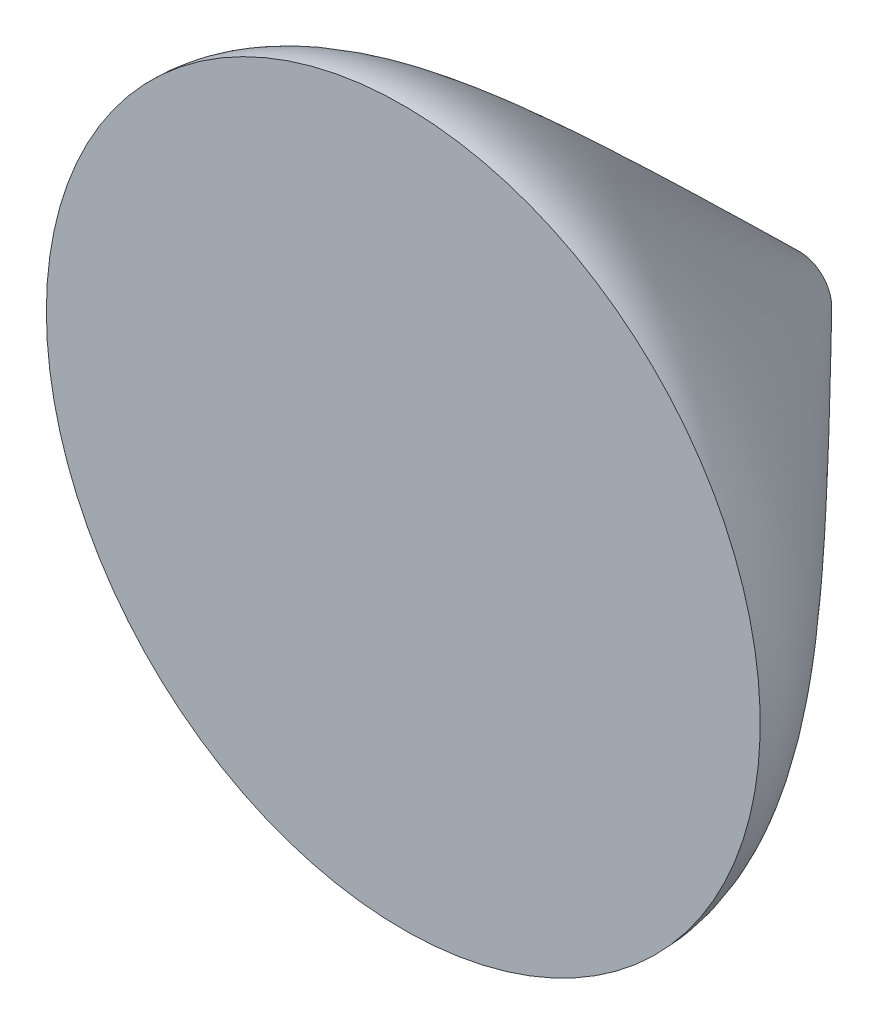
from build123d import *

# Parameters (mm, degrees)
SKETCH2_W = 4.5
SKETCH2_H = 5


with BuildPart() as part:
    # Sketch2 → Revolve1 (revolve)
    with BuildSketch(Plane(origin=(0, 0, 0), x_dir=(1, 0, 0), z_dir=(0, 1, 0))):
        with Locations((-2.25, 0)):
            Rectangle(SKETCH2_W, SKETCH2_H)
    revolve(axis=Axis((0, 0, -2.5), (0, 0, 1)))

    # Sketch3 → Cut-Revolve5 (revolve, cut)
    with BuildSketch(Plane(origin=(0, 0, 0), x_dir=(1, 0, 0), z_dir=(0, 1, 0))):
        with BuildLine():
            Line((-4.5, 2.5), (-4.5, -2.5))
            add(Edge.make_bspline(
                [(-4.5, -2.5), (-4.499996897, -2.474808213), (-4.498705661, -2.436294843), (-4.494183981, -2.383169856), (-4.483512447, -2.313852145), (-4.470479801, -2.251866197), (-4.452112597, -2.183766932), (-4.427062126, -2.10830651), (-4.393633977, -2.023800352), (-4.348123135, -1.925281593), (-4.284562236, -1.805625101), (-4.189915094, -1.649201073), (-4.037874892, -1.427172183), (-3.754032581, -1.058556653), (-3.139196221, -0.345713375), (-2.231635042, 0.619063958), (-1.396596117, 1.482405659), (-0.71494574, 2.179886342), (-0.40103856, 2.5)],
                knots=[0, 0, 0, 0, 0, 0.003316977, 0.005078013, 0.007018133, 0.009237411, 0.011658526, 0.014368721, 0.017485795, 0.021213513, 0.025937595, 0.032237289, 0.041523746, 0.056725141, 0.087084544, 0.156505292, 0.215510652, 0.215510652, 0.215510652, 0.215510652, 0.215510652], degree=4))
            Line((-0.40103856, 2.5), (-4.5, 2.5))
        make_face()
    revolve(axis=Axis((0, 0, -2.5), (0, 0, 1)), mode=Mode.SUBTRACT)


solid = part.part
